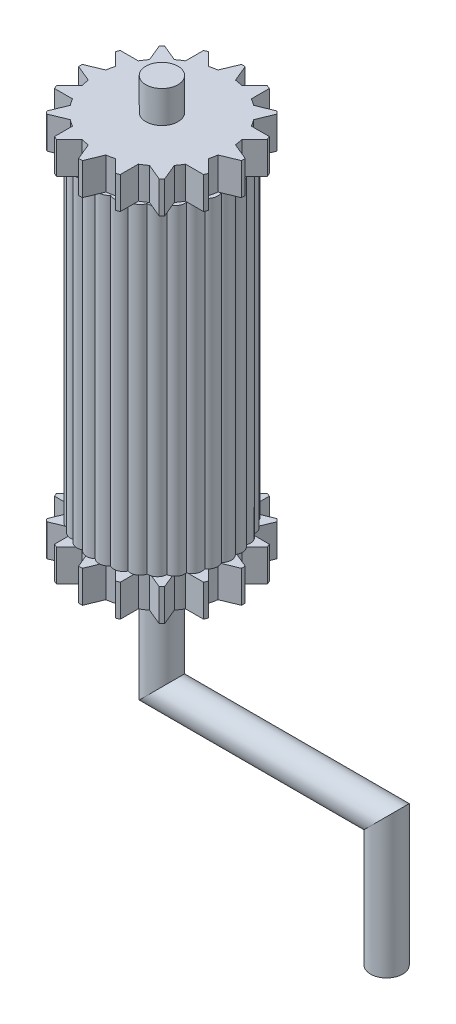
from build123d import *

# Parameters (mm, degrees)
BOSS_EXTRUDE2_DEPTH = 100
BOSS_EXTRUDE3_DEPTH = 10
SKETCH4_R           = 5
BOSS_EXTRUDE4_DEPTH = 10
SWEEP1_PROFILE_R    = 5


with BuildPart() as part:
    # Sketch2 → Boss-Extrude2 (new body)
    with BuildSketch(Plane(origin=(0, 0, 0), x_dir=(-1, 0, 0), z_dir=(0, 1, 0))):
        with BuildLine():
            ThreePointArc((20.69149522, 2.174763782), (21.625, 0), (20.69149522, -2.174763782))
            ThreePointArc((20.69149522, -2.174763782), (21.152441866, -4.496090314), (19.78717759, -6.429243732))
            ThreePointArc((19.78717759, -6.429243732), (19.755420522, -8.795679907), (18.01806535, -10.40273488))
            ThreePointArc((18.01806535, -10.40273488), (17.494992503, -12.710856081), (15.461477194, -13.921576596))
            ThreePointArc((15.461477194, -13.921576596), (14.469949363, -16.070506851), (12.229148292, -16.831978612))
            ThreePointArc((12.229148292, -16.831978612), (10.8125, -18.727799357), (8.462346928, -19.006742394))
            ThreePointArc((8.462346928, -19.006742394), (6.682492503, -20.566597165), (4.325700396, -20.350820328))
            ThreePointArc((4.325700396, -20.350820328), (2.260428018, -21.506535987), (0, -20.80546976))
            ThreePointArc((0, -20.80546976), (-2.260428018, -21.506535987), (-4.325700396, -20.350820328))
            ThreePointArc((-4.325700396, -20.350820328), (-6.682492503, -20.566597165), (-8.462346928, -19.006742394))
            ThreePointArc((-8.462346928, -19.006742394), (-10.8125, -18.727799357), (-12.229148292, -16.831978612))
            ThreePointArc((-12.229148292, -16.831978612), (-14.469949363, -16.070506851), (-15.461477194, -13.921576596))
            ThreePointArc((-15.461477194, -13.921576596), (-17.494992503, -12.710856081), (-18.01806535, -10.40273488))
            ThreePointArc((-18.01806535, -10.40273488), (-19.755420522, -8.795679907), (-19.78717759, -6.429243732))
            ThreePointArc((-19.78717759, -6.429243732), (-21.152441866, -4.496090314), (-20.69149522, -2.174763782))
            ThreePointArc((-20.69149522, -2.174763782), (-21.625, 0), (-20.69149522, 2.174763782))
            ThreePointArc((-20.69149522, 2.174763782), (-21.152441866, 4.496090314), (-19.78717759, 6.429243732))
            ThreePointArc((-19.78717759, 6.429243732), (-19.755420522, 8.795679907), (-18.01806535, 10.40273488))
            ThreePointArc((-18.01806535, 10.40273488), (-17.494992503, 12.710856081), (-15.461477194, 13.921576596))
            ThreePointArc((-15.461477194, 13.921576596), (-14.469949363, 16.070506851), (-12.229148292, 16.831978612))
            ThreePointArc((-12.229148292, 16.831978612), (-10.8125, 18.727799357), (-8.462346928, 19.006742394))
            ThreePointArc((-8.462346928, 19.006742394), (-6.682492503, 20.566597165), (-4.325700396, 20.350820328))
            ThreePointArc((-4.325700396, 20.350820328), (-2.260428018, 21.506535987), (0, 20.80546976))
            ThreePointArc((0, 20.80546976), (2.260428018, 21.506535987), (4.325700396, 20.350820328))
            ThreePointArc((4.325700396, 20.350820328), (6.682492503, 20.566597165), (8.462346928, 19.006742394))
            ThreePointArc((8.462346928, 19.006742394), (10.8125, 18.727799357), (12.229148292, 16.831978612))
            ThreePointArc((12.229148292, 16.831978612), (14.469949363, 16.070506851), (15.461477194, 13.921576596))
            ThreePointArc((15.461477194, 13.921576596), (17.494992503, 12.710856081), (18.01806535, 10.40273488))
            ThreePointArc((18.01806535, 10.40273488), (19.755420522, 8.795679907), (19.78717759, 6.429243732))
            ThreePointArc((19.78717759, 6.429243732), (21.152441866, 4.496090314), (20.69149522, 2.174763782))
        make_face()
    extrude(amount=BOSS_EXTRUDE2_DEPTH)

    # Sketch3 → Boss-Extrude3 (add)
    with BuildSketch(Plane.XZ):
        with BuildLine():
            Line((-2.733, 20.190872591), (-0.588491123, 25.368175007))
            ThreePointArc((-0.588491123, 25.368175007), (0, 25.375), (0.588491123, 25.368175007))
            Line((0.588491123, 25.368175007), (2.733, 20.190872591))
            ThreePointArc((2.733, 20.190872591), (3.974965311, 19.983500088), (5.201749663, 19.699807751))
            Line((5.201749663, 19.699807751), (9.164285381, 23.662343469))
            ThreePointArc((9.164285381, 23.662343469), (9.710592096, 23.443443137), (10.251675188, 23.211931864))
            Line((10.251675188, 23.211931864), (10.251675188, 17.60806011))
            ThreePointArc((10.251675188, 17.60806011), (11.319743498, 16.941193351), (12.344580094, 16.20962576))
            Line((12.344580094, 16.20962576), (17.52188251, 18.354134638))
            ThreePointArc((17.52188251, 18.354134638), (17.942834573, 17.942834573), (18.354134638, 17.52188251))
            Line((18.354134638, 17.52188251), (16.20962576, 12.344580094))
            ThreePointArc((16.20962576, 12.344580094), (16.941193351, 11.319743498), (17.60806011, 10.251675188))
            Line((17.60806011, 10.251675188), (23.211931864, 10.251675188))
            ThreePointArc((23.211931864, 10.251675188), (23.443443137, 9.710592096), (23.662343469, 9.164285381))
            Line((23.662343469, 9.164285381), (19.699807751, 5.201749663))
            ThreePointArc((19.699807751, 5.201749663), (19.983500088, 3.974965311), (20.190872591, 2.733))
            Line((20.190872591, 2.733), (25.368175007, 0.588491123))
            ThreePointArc((25.368175007, 0.588491123), (25.375, 0), (25.368175007, -0.588491123))
            Line((25.368175007, -0.588491123), (20.190872591, -2.733))
            ThreePointArc((20.190872591, -2.733), (19.983500088, -3.974965311), (19.699807751, -5.201749663))
            Line((19.699807751, -5.201749663), (23.662343469, -9.164285381))
            ThreePointArc((23.662343469, -9.164285381), (23.443443137, -9.710592096), (23.211931864, -10.251675188))
            Line((23.211931864, -10.251675188), (17.60806011, -10.251675188))
            ThreePointArc((17.60806011, -10.251675188), (16.941193351, -11.319743498), (16.20962576, -12.344580094))
            Line((16.20962576, -12.344580094), (18.354134638, -17.52188251))
            ThreePointArc((18.354134638, -17.52188251), (17.942834573, -17.942834573), (17.52188251, -18.354134638))
            Line((17.52188251, -18.354134638), (12.344580094, -16.20962576))
            ThreePointArc((12.344580094, -16.20962576), (11.319743498, -16.941193351), (10.251675188, -17.60806011))
            Line((10.251675188, -17.60806011), (10.251675188, -23.211931864))
            ThreePointArc((10.251675188, -23.211931864), (9.710592096, -23.443443137), (9.164285381, -23.662343469))
            Line((9.164285381, -23.662343469), (5.201749663, -19.699807751))
            ThreePointArc((5.201749663, -19.699807751), (3.974965311, -19.983500088), (2.733, -20.190872591))
            Line((2.733, -20.190872591), (0.588491123, -25.368175007))
            ThreePointArc((0.588491123, -25.368175007), (0, -25.375), (-0.588491123, -25.368175007))
            Line((-0.588491123, -25.368175007), (-2.733, -20.190872591))
            ThreePointArc((-2.733, -20.190872591), (-3.974965311, -19.983500088), (-5.201749663, -19.699807751))
            Line((-5.201749663, -19.699807751), (-9.164285381, -23.662343469))
            ThreePointArc((-9.164285381, -23.662343469), (-9.710592096, -23.443443137), (-10.251675188, -23.211931864))
            Line((-10.251675188, -23.211931864), (-10.251675188, -17.60806011))
            ThreePointArc((-10.251675188, -17.60806011), (-11.319743498, -16.941193351), (-12.344580094, -16.20962576))
            Line((-12.344580094, -16.20962576), (-17.52188251, -18.354134638))
            ThreePointArc((-17.52188251, -18.354134638), (-17.942834573, -17.942834573), (-18.354134638, -17.52188251))
            Line((-18.354134638, -17.52188251), (-16.20962576, -12.344580094))
            ThreePointArc((-16.20962576, -12.344580094), (-16.941193351, -11.319743498), (-17.60806011, -10.251675188))
            Line((-17.60806011, -10.251675188), (-23.211931864, -10.251675188))
            ThreePointArc((-23.211931864, -10.251675188), (-23.443443137, -9.710592096), (-23.662343469, -9.164285381))
            Line((-23.662343469, -9.164285381), (-19.699807751, -5.201749663))
            ThreePointArc((-19.699807751, -5.201749663), (-19.983500088, -3.974965311), (-20.190872591, -2.733))
            Line((-20.190872591, -2.733), (-25.368175007, -0.588491123))
            ThreePointArc((-25.368175007, -0.588491123), (-25.375, 0), (-25.368175007, 0.588491123))
            Line((-25.368175007, 0.588491123), (-20.190872591, 2.733))
            ThreePointArc((-20.190872591, 2.733), (-19.983500088, 3.974965311), (-19.699807751, 5.201749663))
            Line((-19.699807751, 5.201749663), (-23.662343469, 9.164285381))
            ThreePointArc((-23.662343469, 9.164285381), (-23.443443137, 9.710592096), (-23.211931864, 10.251675188))
            Line((-23.211931864, 10.251675188), (-17.60806011, 10.251675188))
            ThreePointArc((-17.60806011, 10.251675188), (-16.941193351, 11.319743498), (-16.20962576, 12.344580094))
            Line((-16.20962576, 12.344580094), (-18.354134638, 17.52188251))
            ThreePointArc((-18.354134638, 17.52188251), (-17.942834573, 17.942834573), (-17.52188251, 18.354134638))
            Line((-17.52188251, 18.354134638), (-12.344580094, 16.20962576))
            ThreePointArc((-12.344580094, 16.20962576), (-11.319743498, 16.941193351), (-10.251675188, 17.60806011))
            Line((-10.251675188, 17.60806011), (-10.251675188, 23.211931864))
            ThreePointArc((-10.251675188, 23.211931864), (-9.710592096, 23.443443137), (-9.164285381, 23.662343469))
            Line((-9.164285381, 23.662343469), (-5.201749663, 19.699807751))
            ThreePointArc((-5.201749663, 19.699807751), (-3.974965311, 19.983500088), (-2.733, 20.190872591))
        make_face()
    boss_extrude3 = extrude(amount=BOSS_EXTRUDE3_DEPTH)

    # Mirror1: Boss-Extrude3 across plane
    add(boss_extrude3.mirror(Plane.ZX.offset(50)))

    # Sketch4 → Boss-Extrude4 (add)
    with BuildSketch(Plane.XZ.offset(10)):
        with Locations(Location((0, 0, 0), (0, 0, 270))):
            Circle(SKETCH4_R)
    boss_extrude4 = extrude(amount=BOSS_EXTRUDE4_DEPTH)

    # Mirror2: Boss-Extrude4 across plane
    add(boss_extrude4.mirror(Plane.ZX.offset(50)))

    # Sweep1: sweep along a path in Sketch6
    with BuildLine(Plane(origin=(0, 0, 0), x_dir=(0, 1, 0), z_dir=(0, 0, 1))) as sweep1_path:
        Line((-20, 0), (-45, 0))
        Line((-45, 0), (-45, -70))
        Line((-45, -70), (-85, -70))
    # Sweep1 profile (on start of the path) → Sweep1 (sweep)
    with BuildSketch(Plane(origin=(0, -20, 0), x_dir=(-1, 0, 0), z_dir=(0, -1, 0))):
        Circle(SWEEP1_PROFILE_R)
    sweep(path=sweep1_path.line, transition=Transition.RIGHT)


solid = part.part
